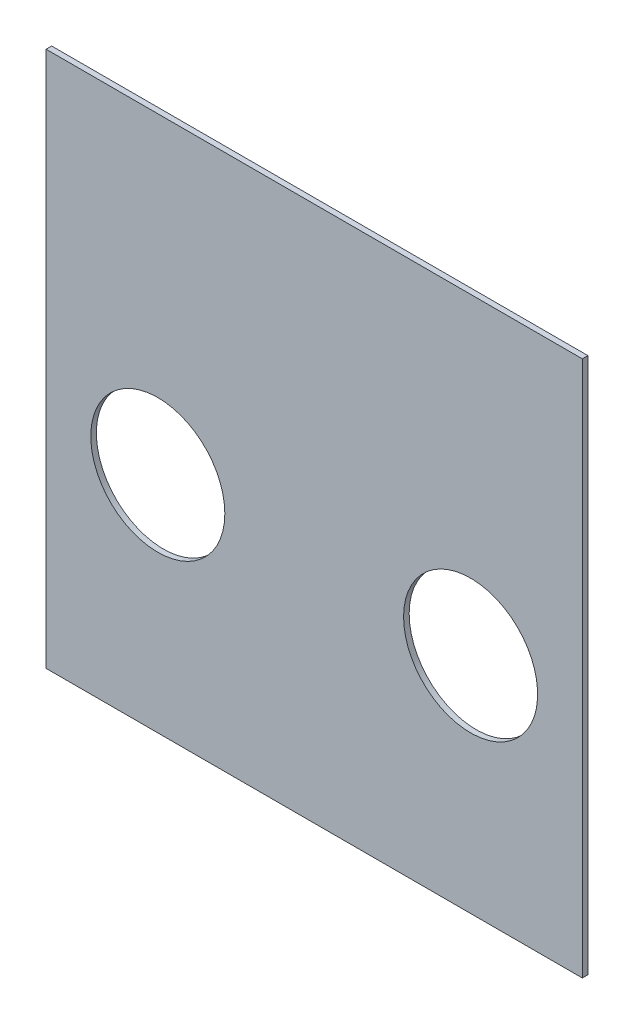
from build123d import *

# Parameters (mm, degrees)
SKETCH1_W           = 609.6
SKETCH1_H           = 609.6
BOSS_EXTRUDE1_DEPTH = 6.35
SKETCH2_R           = 76.2
CUT_EXTRUDE1_DEPTH  = 432.099063441


with BuildPart() as part:
    # Sketch1 → Boss-Extrude1 (new body)
    with BuildSketch(Plane.XY):
        Rectangle(SKETCH1_W, SKETCH1_H)
    extrude(amount=BOSS_EXTRUDE1_DEPTH)

    # Sketch2 → Cut-Extrude1 (cut, through all)
    with BuildSketch(Plane.XY.offset(6.35)):
        with Locations((-177.8, -50.8)):
            Circle(SKETCH2_R)
        with Locations(Location((177.8, -50.8, 0), (0, 0, 180))):
            Circle(SKETCH2_R)
    extrude(amount=-CUT_EXTRUDE1_DEPTH, mode=Mode.SUBTRACT)


solid = part.part
